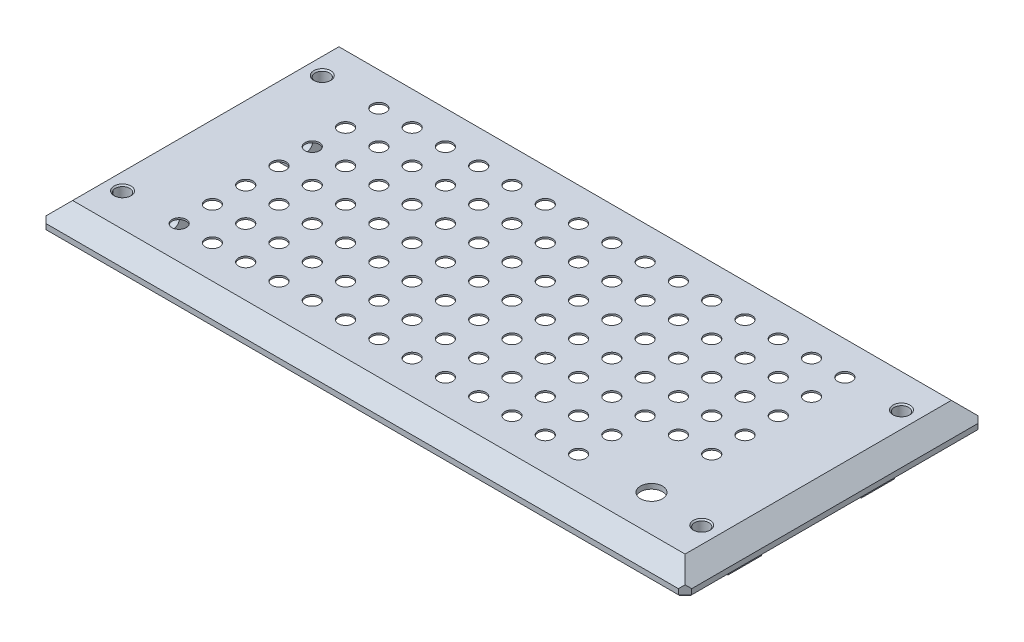
from build123d import *

# Parameters (mm, degrees)
SKETCH1_W           = 194
SKETCH1_H           = 90
BOSS_EXTRUDE1_DEPTH = 2
CHAMFER2_SIZE       = 2
SKETCH4_W           = 8
SKETCH4_H           = 10
BOSS_EXTRUDE2_DEPTH = 7
SKETCH5_R           = 2.05
CUT_EXTRUDE1_DEPTH  = 193.368422689
SKETCH6_W           = 161.8
SKETCH6_H           = 78
CUT_EXTRUDE2_DEPTH  = 5.5
SKETCH7_R           = 2.15
CUT_EXTRUDE3_DEPTH  = 108.658023521
SKETCH8_R           = 4.2
CUT_EXTRUDE4_DEPTH  = 1
SKETCH13_R          = 4.2
BOSS_EXTRUDE3_DEPTH = 1.5
SKETCH10_R          = 3.3
CUT_EXTRUDE5_DEPTH  = 108.658023521
SKETCH11_W          = 10
SKETCH11_H          = 20
CUT_EXTRUDE6_DEPTH  = 5.5
SKETCH12_R          = 2.15
CUT_EXTRUDE7_DEPTH  = 108.158760863
CHAMFER3_SIZE       = 0.4
CHAMFER4_SIZE       = 0.4
CHAMFER5_SIZE       = 0.4


with BuildPart() as part:
    # Sketch1 → Boss-Extrude1 (new body)
    with BuildSketch(Plane(origin=(0, 0, 0), x_dir=(1, 0, 0), z_dir=(0, 1, 0))):
        Rectangle(SKETCH1_W, SKETCH1_H)
    extrude(amount=BOSS_EXTRUDE1_DEPTH)

    # Sketch3 → Loft1 section 0
    with BuildSketch(Plane(origin=(0, 7, 0), x_dir=(1, 0, 0), z_dir=(0, 1, 0))):
        with BuildLine():
            Line((-92, -40), (92, -40))
            Line((92, -40), (92, 40))
            Line((92, 40), (-92, 40))
            Line((-92, 40), (-92, -40))
        make_face()
    # Sketch2 → Loft1 section 1
    with BuildSketch(Plane(origin=(0, 2, 0), x_dir=(1, 0, 0), z_dir=(0, 1, 0))):
        with BuildLine():
            Line((97, -45), (97, 45))
            Line((97, 45), (-97, 45))
            Line((-97, 45), (-97, -45))
            Line((-97, -45), (97, -45))
        make_face()
    loft()

    # Chamfer2
    chamfer2_edges = [part.edges().sort_by_distance(p)[0] for p in [
        (97, 1, 45),
        (-97, 1, 45),
        (-97, 1, -45),
        (97, 1, -45),
    ]]
    chamfer(chamfer2_edges, length=CHAMFER2_SIZE)

    # Sketch4 → Boss-Extrude2 (add)
    with BuildSketch(Plane.XZ):
        with Locations((-85.9, 20)):
            Rectangle(SKETCH4_W, SKETCH4_H)
        with Locations((-85.9, -20)):
            Rectangle(SKETCH4_W, SKETCH4_H)
        with Locations((85.9, -20)):
            Rectangle(SKETCH4_W, SKETCH4_H)
        with Locations((85.9, 20)):
            Rectangle(SKETCH4_W, SKETCH4_H)
    extrude(amount=BOSS_EXTRUDE2_DEPTH)

    # Sketch5 → Cut-Extrude1 (cut, through all)
    with BuildSketch(Plane.ZY.offset(89.9)):
        with Locations((-20, -3.5)):
            Circle(SKETCH5_R)
        with Locations((20, -3.5)):
            Circle(SKETCH5_R)
    extrude(amount=-CUT_EXTRUDE1_DEPTH, mode=Mode.SUBTRACT)

    # Sketch6 → Cut-Extrude2 (cut)
    with BuildSketch(Plane.XZ):
        Rectangle(SKETCH6_W, SKETCH6_H)
    extrude(amount=-CUT_EXTRUDE2_DEPTH, mode=Mode.SUBTRACT)

    # Sketch7 → Cut-Extrude3 (cut, through all)
    with BuildSketch(Plane.XZ.offset(-5.5)):
        with Locations(Location((0, 0, 0), (0, 0, 270))):
            Circle(SKETCH7_R)
        with Locations(Location((10, 0, 0), (0, 0, 270))):
            Circle(SKETCH7_R)
        with Locations(Location((20, 0, 0), (0, 0, 270))):
            Circle(SKETCH7_R)
        with Locations(Location((30, 0, 0), (0, 0, 270))):
            Circle(SKETCH7_R)
        with Locations(Location((40, 0, 0), (0, 0, 270))):
            Circle(SKETCH7_R)
        with Locations(Location((50, 0, 0), (0, 0, 270))):
            Circle(SKETCH7_R)
        with Locations(Location((10, 10, 0), (0, 0, 270))):
            Circle(SKETCH7_R)
        with Locations(Location((20, 10, 0), (0, 0, 270))):
            Circle(SKETCH7_R)
        with Locations(Location((30, 10, 0), (0, 0, 270))):
            Circle(SKETCH7_R)
        with Locations(Location((40, 10, 0), (0, 0, 270))):
            Circle(SKETCH7_R)
        with Locations(Location((50, 10, 0), (0, 0, 270))):
            Circle(SKETCH7_R)
        with Locations(Location((10, 20, 0), (0, 0, 270))):
            Circle(SKETCH7_R)
        with Locations(Location((20, 20, 0), (0, 0, 270))):
            Circle(SKETCH7_R)
        with Locations(Location((30, 20, 0), (0, 0, 270))):
            Circle(SKETCH7_R)
        with Locations(Location((40, 20, 0), (0, 0, 270))):
            Circle(SKETCH7_R)
        with Locations(Location((50, 20, 0), (0, 0, 270))):
            Circle(SKETCH7_R)
        with Locations(Location((10, 30, 0), (0, 0, 270))):
            Circle(SKETCH7_R)
        with Locations(Location((20, 30, 0), (0, 0, 270))):
            Circle(SKETCH7_R)
        with Locations(Location((30, 30, 0), (0, 0, 270))):
            Circle(SKETCH7_R)
        with Locations(Location((40, 30, 0), (0, 0, 270))):
            Circle(SKETCH7_R)
        with Locations(Location((50, 30, 0), (0, 0, 270))):
            Circle(SKETCH7_R)
        with Locations(Location((0, 10, 0), (0, 0, 270))):
            Circle(SKETCH7_R)
        with Locations(Location((0, 20, 0), (0, 0, 270))):
            Circle(SKETCH7_R)
        with Locations(Location((0, 30, 0), (0, 0, 270))):
            Circle(SKETCH7_R)
        with Locations(Location((-50, 30, 0), (0, 0, 270))):
            Circle(SKETCH7_R)
        with Locations(Location((-40, 30, 0), (0, 0, 270))):
            Circle(SKETCH7_R)
        with Locations(Location((-30, 30, 0), (0, 0, 270))):
            Circle(SKETCH7_R)
        with Locations(Location((-20, 30, 0), (0, 0, 270))):
            Circle(SKETCH7_R)
        with Locations(Location((-10, 30, 0), (0, 0, 270))):
            Circle(SKETCH7_R)
        with Locations(Location((-50, 20, 0), (0, 0, 270))):
            Circle(SKETCH7_R)
        with Locations(Location((-40, 20, 0), (0, 0, 270))):
            Circle(SKETCH7_R)
        with Locations(Location((-30, 20, 0), (0, 0, 270))):
            Circle(SKETCH7_R)
        with Locations(Location((-20, 20, 0), (0, 0, 270))):
            Circle(SKETCH7_R)
        with Locations(Location((-10, 20, 0), (0, 0, 270))):
            Circle(SKETCH7_R)
        with Locations(Location((-50, 10, 0), (0, 0, 270))):
            Circle(SKETCH7_R)
        with Locations(Location((-40, 10, 0), (0, 0, 270))):
            Circle(SKETCH7_R)
        with Locations(Location((-30, 10, 0), (0, 0, 270))):
            Circle(SKETCH7_R)
        with Locations(Location((-20, 10, 0), (0, 0, 270))):
            Circle(SKETCH7_R)
        with Locations(Location((-10, 10, 0), (0, 0, 270))):
            Circle(SKETCH7_R)
        with Locations(Location((-50, 0, 0), (0, 0, 270))):
            Circle(SKETCH7_R)
        with Locations(Location((-40, 0, 0), (0, 0, 270))):
            Circle(SKETCH7_R)
        with Locations(Location((-30, 0, 0), (0, 0, 270))):
            Circle(SKETCH7_R)
        with Locations(Location((-20, 0, 0), (0, 0, 270))):
            Circle(SKETCH7_R)
        with Locations(Location((-10, 0, 0), (0, 0, 270))):
            Circle(SKETCH7_R)
        with Locations(Location((-10, -10, 0), (0, 0, 270))):
            Circle(SKETCH7_R)
        with Locations(Location((-20, -10, 0), (0, 0, 270))):
            Circle(SKETCH7_R)
        with Locations(Location((-30, -10, 0), (0, 0, 270))):
            Circle(SKETCH7_R)
        with Locations(Location((-40, -10, 0), (0, 0, 270))):
            Circle(SKETCH7_R)
        with Locations(Location((-50, -10, 0), (0, 0, 270))):
            Circle(SKETCH7_R)
        with Locations(Location((-10, -20, 0), (0, 0, 270))):
            Circle(SKETCH7_R)
        with Locations(Location((-20, -20, 0), (0, 0, 270))):
            Circle(SKETCH7_R)
        with Locations(Location((-30, -20, 0), (0, 0, 270))):
            Circle(SKETCH7_R)
        with Locations(Location((-40, -20, 0), (0, 0, 270))):
            Circle(SKETCH7_R)
        with Locations(Location((-50, -20, 0), (0, 0, 270))):
            Circle(SKETCH7_R)
        with Locations(Location((-10, -30, 0), (0, 0, 270))):
            Circle(SKETCH7_R)
        with Locations(Location((-20, -30, 0), (0, 0, 270))):
            Circle(SKETCH7_R)
        with Locations(Location((-30, -30, 0), (0, 0, 270))):
            Circle(SKETCH7_R)
        with Locations(Location((-40, -30, 0), (0, 0, 270))):
            Circle(SKETCH7_R)
        with Locations(Location((-50, -30, 0), (0, 0, 270))):
            Circle(SKETCH7_R)
        with Locations(Location((0, -30, 0), (0, 0, 270))):
            Circle(SKETCH7_R)
        with Locations(Location((0, -20, 0), (0, 0, 270))):
            Circle(SKETCH7_R)
        with Locations(Location((0, -10, 0), (0, 0, 270))):
            Circle(SKETCH7_R)
        with Locations(Location((50, -30, 0), (0, 0, 270))):
            Circle(SKETCH7_R)
        with Locations(Location((40, -30, 0), (0, 0, 270))):
            Circle(SKETCH7_R)
        with Locations(Location((30, -30, 0), (0, 0, 270))):
            Circle(SKETCH7_R)
        with Locations(Location((20, -30, 0), (0, 0, 270))):
            Circle(SKETCH7_R)
        with Locations(Location((10, -30, 0), (0, 0, 270))):
            Circle(SKETCH7_R)
        with Locations(Location((50, -20, 0), (0, 0, 270))):
            Circle(SKETCH7_R)
        with Locations(Location((40, -20, 0), (0, 0, 270))):
            Circle(SKETCH7_R)
        with Locations(Location((30, -20, 0), (0, 0, 270))):
            Circle(SKETCH7_R)
        with Locations(Location((20, -20, 0), (0, 0, 270))):
            Circle(SKETCH7_R)
        with Locations(Location((10, -20, 0), (0, 0, 270))):
            Circle(SKETCH7_R)
        with Locations(Location((50, -10, 0), (0, 0, 270))):
            Circle(SKETCH7_R)
        with Locations(Location((40, -10, 0), (0, 0, 270))):
            Circle(SKETCH7_R)
        with Locations(Location((30, -10, 0), (0, 0, 270))):
            Circle(SKETCH7_R)
        with Locations(Location((20, -10, 0), (0, 0, 270))):
            Circle(SKETCH7_R)
        with Locations(Location((10, -10, 0), (0, 0, 270))):
            Circle(SKETCH7_R)
        with Locations(Location((60, 0, 0), (0, 0, 270))):
            Circle(SKETCH7_R)
        with Locations(Location((70, 0, 0), (0, 0, 270))):
            Circle(SKETCH7_R)
        with Locations(Location((60, 10, 0), (0, 0, 270))):
            Circle(SKETCH7_R)
        with Locations(Location((70, 10, 0), (0, 0, 270))):
            Circle(SKETCH7_R)
        with Locations(Location((60, 20, 0), (0, 0, 270))):
            Circle(SKETCH7_R)
        with Locations(Location((70, 20, 0), (0, 0, 270))):
            Circle(SKETCH7_R)
        with Locations(Location((60, 30, 0), (0, 0, 270))):
            Circle(SKETCH7_R)
        with Locations(Location((70, 30, 0), (0, 0, 270))):
            Circle(SKETCH7_R)
        with Locations(Location((70, -30, 0), (0, 0, 270))):
            Circle(SKETCH7_R)
        with Locations(Location((60, -30, 0), (0, 0, 270))):
            Circle(SKETCH7_R)
        with Locations(Location((70, -20, 0), (0, 0, 270))):
            Circle(SKETCH7_R)
        with Locations(Location((60, -20, 0), (0, 0, 270))):
            Circle(SKETCH7_R)
        with Locations(Location((70, -10, 0), (0, 0, 270))):
            Circle(SKETCH7_R)
        with Locations(Location((60, -10, 0), (0, 0, 270))):
            Circle(SKETCH7_R)
        with Locations(Location((-60, -10, 0), (0, 0, 270))):
            Circle(SKETCH7_R)
        with Locations(Location((-70, -10, 0), (0, 0, 270))):
            Circle(SKETCH7_R)
        with Locations(Location((-60, -20, 0), (0, 0, 270))):
            Circle(SKETCH7_R)
        with Locations(Location((-70, -20, 0), (0, 0, 270))):
            Circle(SKETCH7_R)
        with Locations(Location((-60, -30, 0), (0, 0, 270))):
            Circle(SKETCH7_R)
        with Locations(Location((-70, -30, 0), (0, 0, 270))):
            Circle(SKETCH7_R)
        with Locations(Location((-70, 30, 0), (0, 0, 270))):
            Circle(SKETCH7_R)
        with Locations(Location((-60, 30, 0), (0, 0, 270))):
            Circle(SKETCH7_R)
        with Locations(Location((-70, 20, 0), (0, 0, 270))):
            Circle(SKETCH7_R)
        with Locations(Location((-60, 20, 0), (0, 0, 270))):
            Circle(SKETCH7_R)
        with Locations(Location((-70, 10, 0), (0, 0, 270))):
            Circle(SKETCH7_R)
        with Locations(Location((-60, 10, 0), (0, 0, 270))):
            Circle(SKETCH7_R)
        with Locations(Location((-70, 0, 0), (0, 0, 270))):
            Circle(SKETCH7_R)
        with Locations(Location((-60, 0, 0), (0, 0, 270))):
            Circle(SKETCH7_R)
    extrude(amount=-CUT_EXTRUDE3_DEPTH, mode=Mode.SUBTRACT)

    # Sketch8 → Cut-Extrude4 (cut)
    with BuildSketch(Plane.XZ.offset(-5.5)):
        with Locations(Location((0, 0, 0), (0, 0, 270))):
            Circle(SKETCH8_R)
        with Locations(Location((10, 0, 0), (0, 0, 270))):
            Circle(SKETCH8_R)
        with Locations(Location((20, 0, 0), (0, 0, 270))):
            Circle(SKETCH8_R)
        with Locations(Location((30, 0, 0), (0, 0, 270))):
            Circle(SKETCH8_R)
        with Locations(Location((40, 0, 0), (0, 0, 270))):
            Circle(SKETCH8_R)
        with Locations(Location((50, 0, 0), (0, 0, 270))):
            Circle(SKETCH8_R)
        with Locations(Location((10, 10, 0), (0, 0, 270))):
            Circle(SKETCH8_R)
        with Locations(Location((20, 10, 0), (0, 0, 270))):
            Circle(SKETCH8_R)
        with Locations(Location((30, 10, 0), (0, 0, 270))):
            Circle(SKETCH8_R)
        with Locations(Location((40, 10, 0), (0, 0, 270))):
            Circle(SKETCH8_R)
        with Locations(Location((50, 10, 0), (0, 0, 270))):
            Circle(SKETCH8_R)
        with Locations(Location((10, 20, 0), (0, 0, 270))):
            Circle(SKETCH8_R)
        with Locations(Location((20, 20, 0), (0, 0, 270))):
            Circle(SKETCH8_R)
        with Locations(Location((30, 20, 0), (0, 0, 270))):
            Circle(SKETCH8_R)
        with Locations(Location((40, 20, 0), (0, 0, 270))):
            Circle(SKETCH8_R)
        with Locations(Location((50, 20, 0), (0, 0, 270))):
            Circle(SKETCH8_R)
        with Locations(Location((10, 30, 0), (0, 0, 270))):
            Circle(SKETCH8_R)
        with Locations(Location((20, 30, 0), (0, 0, 270))):
            Circle(SKETCH8_R)
        with Locations(Location((30, 30, 0), (0, 0, 270))):
            Circle(SKETCH8_R)
        with Locations(Location((40, 30, 0), (0, 0, 270))):
            Circle(SKETCH8_R)
        with Locations(Location((50, 30, 0), (0, 0, 270))):
            Circle(SKETCH8_R)
        with Locations(Location((0, 10, 0), (0, 0, 270))):
            Circle(SKETCH8_R)
        with Locations(Location((0, 20, 0), (0, 0, 270))):
            Circle(SKETCH8_R)
        with Locations(Location((0, 30, 0), (0, 0, 270))):
            Circle(SKETCH8_R)
        with Locations(Location((0, -30, 0), (0, 0, 90))):
            Circle(SKETCH8_R)
        with Locations(Location((0, -20, 0), (0, 0, 90))):
            Circle(SKETCH8_R)
        with Locations(Location((0, -10, 0), (0, 0, 90))):
            Circle(SKETCH8_R)
        with Locations(Location((50, -30, 0), (0, 0, 90))):
            Circle(SKETCH8_R)
        with Locations(Location((40, -30, 0), (0, 0, 90))):
            Circle(SKETCH8_R)
        with Locations(Location((30, -30, 0), (0, 0, 90))):
            Circle(SKETCH8_R)
        with Locations(Location((20, -30, 0), (0, 0, 90))):
            Circle(SKETCH8_R)
        with Locations(Location((10, -30, 0), (0, 0, 90))):
            Circle(SKETCH8_R)
        with Locations(Location((50, -20, 0), (0, 0, 90))):
            Circle(SKETCH8_R)
        with Locations(Location((40, -20, 0), (0, 0, 90))):
            Circle(SKETCH8_R)
        with Locations(Location((30, -20, 0), (0, 0, 90))):
            Circle(SKETCH8_R)
        with Locations(Location((20, -20, 0), (0, 0, 90))):
            Circle(SKETCH8_R)
        with Locations(Location((10, -20, 0), (0, 0, 90))):
            Circle(SKETCH8_R)
        with Locations(Location((50, -10, 0), (0, 0, 90))):
            Circle(SKETCH8_R)
        with Locations(Location((40, -10, 0), (0, 0, 90))):
            Circle(SKETCH8_R)
        with Locations(Location((30, -10, 0), (0, 0, 90))):
            Circle(SKETCH8_R)
        with Locations(Location((20, -10, 0), (0, 0, 90))):
            Circle(SKETCH8_R)
        with Locations(Location((10, -10, 0), (0, 0, 90))):
            Circle(SKETCH8_R)
        with Locations(Location((-10, -10, 0), (0, 0, 270))):
            Circle(SKETCH8_R)
        with Locations(Location((-20, -10, 0), (0, 0, 270))):
            Circle(SKETCH8_R)
        with Locations(Location((-30, -10, 0), (0, 0, 270))):
            Circle(SKETCH8_R)
        with Locations(Location((-40, -10, 0), (0, 0, 270))):
            Circle(SKETCH8_R)
        with Locations(Location((-50, -10, 0), (0, 0, 270))):
            Circle(SKETCH8_R)
        with Locations(Location((-10, -20, 0), (0, 0, 270))):
            Circle(SKETCH8_R)
        with Locations(Location((-20, -20, 0), (0, 0, 270))):
            Circle(SKETCH8_R)
        with Locations(Location((-30, -20, 0), (0, 0, 270))):
            Circle(SKETCH8_R)
        with Locations(Location((-40, -20, 0), (0, 0, 270))):
            Circle(SKETCH8_R)
        with Locations(Location((-50, -20, 0), (0, 0, 270))):
            Circle(SKETCH8_R)
        with Locations(Location((-10, -30, 0), (0, 0, 270))):
            Circle(SKETCH8_R)
        with Locations(Location((-20, -30, 0), (0, 0, 270))):
            Circle(SKETCH8_R)
        with Locations(Location((-30, -30, 0), (0, 0, 270))):
            Circle(SKETCH8_R)
        with Locations(Location((-40, -30, 0), (0, 0, 270))):
            Circle(SKETCH8_R)
        with Locations(Location((-50, -30, 0), (0, 0, 270))):
            Circle(SKETCH8_R)
        with Locations(Location((-50, 30, 0), (0, 0, 90))):
            Circle(SKETCH8_R)
        with Locations(Location((-40, 30, 0), (0, 0, 90))):
            Circle(SKETCH8_R)
        with Locations(Location((-30, 30, 0), (0, 0, 90))):
            Circle(SKETCH8_R)
        with Locations(Location((-20, 30, 0), (0, 0, 90))):
            Circle(SKETCH8_R)
        with Locations(Location((-10, 30, 0), (0, 0, 90))):
            Circle(SKETCH8_R)
        with Locations(Location((-50, 20, 0), (0, 0, 90))):
            Circle(SKETCH8_R)
        with Locations(Location((-40, 20, 0), (0, 0, 90))):
            Circle(SKETCH8_R)
        with Locations(Location((-30, 20, 0), (0, 0, 90))):
            Circle(SKETCH8_R)
        with Locations(Location((-20, 20, 0), (0, 0, 90))):
            Circle(SKETCH8_R)
        with Locations(Location((-10, 20, 0), (0, 0, 90))):
            Circle(SKETCH8_R)
        with Locations(Location((-50, 10, 0), (0, 0, 90))):
            Circle(SKETCH8_R)
        with Locations(Location((-40, 10, 0), (0, 0, 90))):
            Circle(SKETCH8_R)
        with Locations(Location((-30, 10, 0), (0, 0, 90))):
            Circle(SKETCH8_R)
        with Locations(Location((-20, 10, 0), (0, 0, 90))):
            Circle(SKETCH8_R)
        with Locations(Location((-10, 10, 0), (0, 0, 90))):
            Circle(SKETCH8_R)
        with Locations(Location((-50, 0, 0), (0, 0, 90))):
            Circle(SKETCH8_R)
        with Locations(Location((-40, 0, 0), (0, 0, 90))):
            Circle(SKETCH8_R)
        with Locations(Location((-30, 0, 0), (0, 0, 90))):
            Circle(SKETCH8_R)
        with Locations(Location((-20, 0, 0), (0, 0, 90))):
            Circle(SKETCH8_R)
        with Locations(Location((-10, 0, 0), (0, 0, 90))):
            Circle(SKETCH8_R)
        with Locations(Location((60, 0, 0), (0, 0, 270))):
            Circle(SKETCH8_R)
        with Locations(Location((70, 0, 0), (0, 0, 270))):
            Circle(SKETCH8_R)
        with Locations(Location((60, 10, 0), (0, 0, 270))):
            Circle(SKETCH8_R)
        with Locations(Location((70, 10, 0), (0, 0, 270))):
            Circle(SKETCH8_R)
        with Locations(Location((60, 20, 0), (0, 0, 270))):
            Circle(SKETCH8_R)
        with Locations(Location((70, 20, 0), (0, 0, 270))):
            Circle(SKETCH8_R)
        with Locations(Location((60, 30, 0), (0, 0, 270))):
            Circle(SKETCH8_R)
        with Locations(Location((70, 30, 0), (0, 0, 270))):
            Circle(SKETCH8_R)
        with Locations(Location((70, -30, 0), (0, 0, 90))):
            Circle(SKETCH8_R)
        with Locations(Location((60, -30, 0), (0, 0, 90))):
            Circle(SKETCH8_R)
        with Locations(Location((70, -20, 0), (0, 0, 90))):
            Circle(SKETCH8_R)
        with Locations(Location((60, -20, 0), (0, 0, 90))):
            Circle(SKETCH8_R)
        with Locations(Location((70, -10, 0), (0, 0, 90))):
            Circle(SKETCH8_R)
        with Locations(Location((60, -10, 0), (0, 0, 90))):
            Circle(SKETCH8_R)
        with Locations(Location((-60, -10, 0), (0, 0, 270))):
            Circle(SKETCH8_R)
        with Locations(Location((-60, -20, 0), (0, 0, 270))):
            Circle(SKETCH8_R)
        with Locations(Location((-60, -30, 0), (0, 0, 270))):
            Circle(SKETCH8_R)
        with Locations(Location((-60, 0, 0), (0, 0, 90))):
            Circle(SKETCH8_R)
        with Locations(Location((-70, -10, 0), (0, 0, 270))):
            Circle(SKETCH8_R)
        with Locations(Location((-70, -20, 0), (0, 0, 270))):
            Circle(SKETCH8_R)
        with Locations(Location((-70, -30, 0), (0, 0, 270))):
            Circle(SKETCH8_R)
        with Locations(Location((-70, 30, 0), (0, 0, 90))):
            Circle(SKETCH8_R)
        with Locations(Location((-60, 30, 0), (0, 0, 90))):
            Circle(SKETCH8_R)
        with Locations(Location((-70, 20, 0), (0, 0, 90))):
            Circle(SKETCH8_R)
        with Locations(Location((-60, 20, 0), (0, 0, 90))):
            Circle(SKETCH8_R)
        with Locations(Location((-70, 10, 0), (0, 0, 90))):
            Circle(SKETCH8_R)
        with Locations(Location((-60, 10, 0), (0, 0, 90))):
            Circle(SKETCH8_R)
        with Locations(Location((-70, 0, 0), (0, 0, 90))):
            Circle(SKETCH8_R)
    extrude(amount=-CUT_EXTRUDE4_DEPTH, mode=Mode.SUBTRACT)

    # Sketch13 → Boss-Extrude3 (add)
    with BuildSketch(Plane.XZ.offset(-5.5)):
        with Locations((60, 20)):
            Circle(SKETCH13_R)
        with Locations((70, 20)):
            Circle(SKETCH13_R)
        with Locations((70, 30)):
            Circle(SKETCH13_R)
        with Locations((60, 30)):
            Circle(SKETCH13_R)
    extrude(amount=-BOSS_EXTRUDE3_DEPTH)

    # Sketch10 → Cut-Extrude5 (cut, through all)
    with BuildSketch(Plane.XZ.offset(-5.5)):
        with Locations(Location((70.9, 29, 0), (0, 0, 270))):
            Circle(SKETCH10_R)
    extrude(amount=-CUT_EXTRUDE5_DEPTH, mode=Mode.SUBTRACT)

    # Sketch11 → Cut-Extrude6 (cut)
    with BuildSketch(Plane.XZ):
        with Locations((85.9, 0)):
            Rectangle(SKETCH11_W, SKETCH11_H)
        with Locations((-85.9, 0)):
            Rectangle(SKETCH11_W, SKETCH11_H)
    extrude(amount=-CUT_EXTRUDE6_DEPTH, mode=Mode.SUBTRACT)

    # Sketch12 → Cut-Extrude7 (cut, through all)
    with BuildSketch(Plane.XZ):
        with Locations(Location((-87, 30, 0), (0, 0, 270))):
            Circle(SKETCH12_R)
        with Locations(Location((-87, -30, 0), (0, 0, 270))):
            Circle(SKETCH12_R)
        with Locations(Location((87, -30, 0), (0, 0, 270))):
            Circle(SKETCH12_R)
        with Locations(Location((87, 30, 0), (0, 0, 270))):
            Circle(SKETCH12_R)
    extrude(amount=-CUT_EXTRUDE7_DEPTH, mode=Mode.SUBTRACT)

    # Chamfer3
    chamfer3_edges = [part.edges().sort_by_distance(p)[0] for p in [
        (0, 0, -45),
        (97, 0, 0),
        (0, 0, 45),
        (-97, 0, 0),
        (96, 0, 44),
        (-96, 0, 44),
        (-96, 0, -44),
        (96, 0, -44),
    ]]
    chamfer(chamfer3_edges, length=CHAMFER3_SIZE)

    # Chamfer4
    chamfer4_edges = [part.edges().sort_by_distance(p)[0] for p in [
        (87, 7, 32.15),
        (87, 7, -27.85),
        (-87, 7, -27.85),
        (-87, 7, 32.15),
    ]]
    chamfer(chamfer4_edges, length=CHAMFER4_SIZE)

    # Chamfer5
    chamfer5_edges = [part.edges().sort_by_distance(p)[0] for p in [
        (89.9, -3.5, -22.05),
        (-89.9, -3.5, -22.05),
        (89.9, -3.5, 17.95),
        (-89.9, -3.5, 17.95),
    ]]
    chamfer(chamfer5_edges, length=CHAMFER5_SIZE)


solid = part.part
